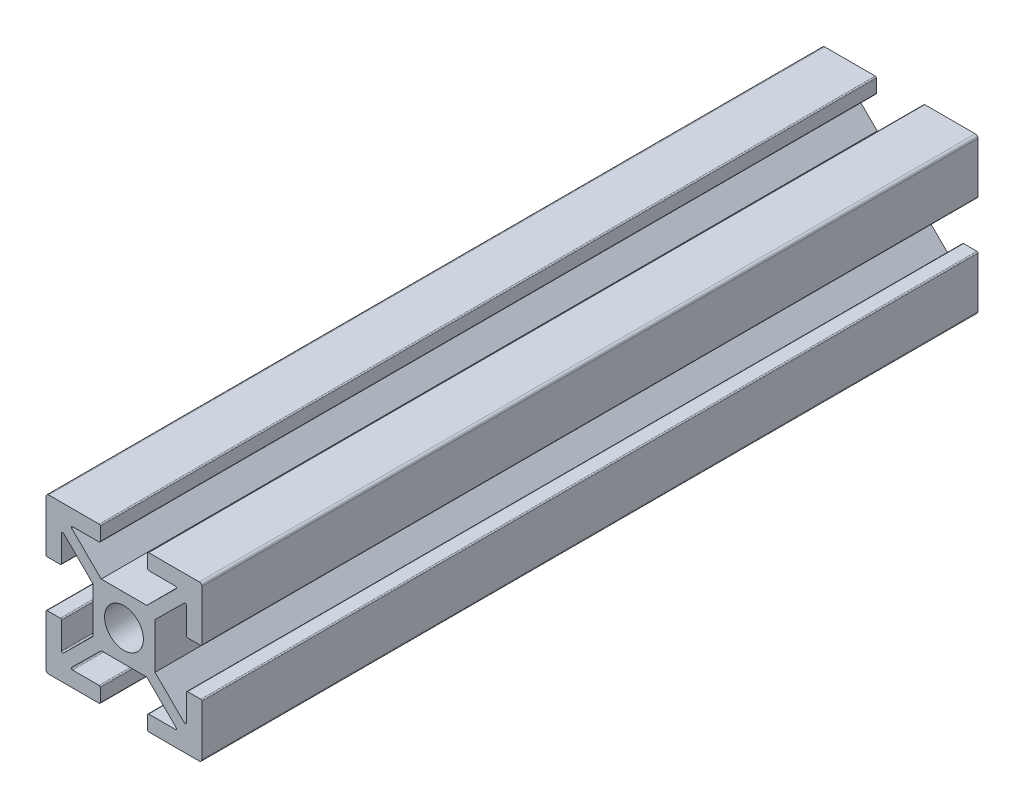
from build123d import *

# Parameters (mm, degrees)
SKETCH1_R           = 2.5
BOSS_EXTRUDE1_DEPTH = 100


with BuildPart() as part:
    # Sketch1 → Boss-Extrude1 (new body)
    with BuildSketch(Plane.XY):
        with BuildLine():
            Line((-7.427382464, 2.155691805), (-5.727382464, 2.155691805))
            ThreePointArc((-5.727382464, 2.155691805), (-5.621316447, 2.199625788), (-5.577382464, 2.305691805))
            Line((-5.577382464, 2.305691805), (-5.577382464, 5.741876319))
            ThreePointArc((-5.577382464, 5.741876319), (-5.485183419, 5.880292537), (-5.321928469, 5.848550846))
            Line((-5.321928469, 5.848550846), (-1.531086168, 2.101082027))
            Line((-1.531086168, 2.101082027), (-1.531086168, -3.789698417))
            Line((-1.531086168, -3.789698417), (-5.321928469, -7.537167236))
            ThreePointArc((-5.321928469, -7.537167236), (-5.485183419, -7.568908927), (-5.577382464, -7.430492708))
            Line((-5.577382464, -7.430492708), (-5.577382464, -3.994308195))
            ThreePointArc((-5.577382464, -3.994308195), (-5.621316447, -3.888242178), (-5.727382464, -3.844308195))
            Line((-5.727382464, -3.844308195), (-7.427382464, -3.844308195))
            ThreePointArc((-7.427382464, -3.844308195), (-7.533448481, -3.888242178), (-7.577382464, -3.994308195))
            Line((-7.577382464, -3.994308195), (-7.577382464, -10.494308195))
            ThreePointArc((-7.577382464, -10.494308195), (-7.474869837, -10.741795568), (-7.227382464, -10.844308195))
            Line((-7.227382464, -10.844308195), (-0.727382464, -10.844308195))
            ThreePointArc((-0.727382464, -10.844308195), (-0.621316447, -10.800374212), (-0.577382464, -10.694308195))
            Line((-0.577382464, -10.694308195), (-0.577382464, -8.994308195))
            ThreePointArc((-0.577382464, -8.994308195), (-0.621316447, -8.888242178), (-0.727382464, -8.844308195))
            Line((-0.727382464, -8.844308195), (-4.145467261, -8.844308195))
            ThreePointArc((-4.145467261, -8.844308195), (-4.284213755, -8.751311795), (-4.250921257, -8.587633667))
            Line((-4.250921257, -8.587633667), (-0.464270258, -4.844308195))
            Line((-0.464270258, -4.844308195), (5.402097922, -4.844308195))
            Line((5.402097922, -4.844308195), (9.188748921, -8.587633667))
            ThreePointArc((9.188748921, -8.587633667), (9.22204142, -8.751311795), (9.083294926, -8.844308195))
            Line((9.083294926, -8.844308195), (5.665210129, -8.844308195))
            ThreePointArc((5.665210129, -8.844308195), (5.559144111, -8.888242178), (5.515210129, -8.994308195))
            Line((5.515210129, -8.994308195), (5.515210129, -10.694308195))
            ThreePointArc((5.515210129, -10.694308195), (5.559144111, -10.800374212), (5.665210129, -10.844308195))
            Line((5.665210129, -10.844308195), (12.165210129, -10.844308195))
            ThreePointArc((12.165210129, -10.844308195), (12.412697502, -10.741795568), (12.515210129, -10.494308195))
            Line((12.515210129, -10.494308195), (12.515210129, -3.994308195))
            ThreePointArc((12.515210129, -3.994308195), (12.471276146, -3.888242178), (12.365210129, -3.844308195))
            Line((12.365210129, -3.844308195), (10.665210129, -3.844308195))
            ThreePointArc((10.665210129, -3.844308195), (10.559144111, -3.888242178), (10.515210129, -3.994308195))
            Line((10.515210129, -3.994308195), (10.515210129, -7.430492708))
            ThreePointArc((10.515210129, -7.430492708), (10.423011083, -7.568908927), (10.259756133, -7.537167236))
            Line((10.259756133, -7.537167236), (6.468913832, -3.789698417))
            Line((6.468913832, -3.789698417), (6.468913832, 2.101082027))
            Line((6.468913832, 2.101082027), (10.259756133, 5.848550846))
            ThreePointArc((10.259756133, 5.848550846), (10.423011083, 5.880292537), (10.515210129, 5.741876319))
            Line((10.515210129, 5.741876319), (10.515210129, 2.305691805))
            ThreePointArc((10.515210129, 2.305691805), (10.559144111, 2.199625788), (10.665210129, 2.155691805))
            Line((10.665210129, 2.155691805), (12.365210129, 2.155691805))
            ThreePointArc((12.365210129, 2.155691805), (12.471276146, 2.199625788), (12.515210129, 2.305691805))
            Line((12.515210129, 2.305691805), (12.515210129, 8.805691805))
            ThreePointArc((12.515210129, 8.805691805), (12.412697502, 9.053179179), (12.165210129, 9.155691805))
            Line((12.165210129, 9.155691805), (5.665210129, 9.155691805))
            ThreePointArc((5.665210129, 9.155691805), (5.559144111, 9.111757822), (5.515210129, 9.005691805))
            Line((5.515210129, 9.005691805), (5.515210129, 7.305691805))
            ThreePointArc((5.515210129, 7.305691805), (5.559144111, 7.199625788), (5.665210129, 7.155691805))
            Line((5.665210129, 7.155691805), (9.083294926, 7.155691805))
            ThreePointArc((9.083294926, 7.155691805), (9.22204142, 7.062695405), (9.188748921, 6.899017277))
            Line((9.188748921, 6.899017277), (5.402097922, 3.155691805))
            Line((5.402097922, 3.155691805), (-0.464270258, 3.155691805))
            Line((-0.464270258, 3.155691805), (-4.250921257, 6.899017277))
            ThreePointArc((-4.250921257, 6.899017277), (-4.284213755, 7.062695405), (-4.145467261, 7.155691805))
            Line((-4.145467261, 7.155691805), (-0.727382464, 7.155691805))
            ThreePointArc((-0.727382464, 7.155691805), (-0.621316447, 7.199625788), (-0.577382464, 7.305691805))
            Line((-0.577382464, 7.305691805), (-0.577382464, 9.005691805))
            ThreePointArc((-0.577382464, 9.005691805), (-0.621316447, 9.111757822), (-0.727382464, 9.155691805))
            Line((-0.727382464, 9.155691805), (-7.227382464, 9.155691805))
            ThreePointArc((-7.227382464, 9.155691805), (-7.474869837, 9.053179179), (-7.577382464, 8.805691805))
            Line((-7.577382464, 8.805691805), (-7.577382464, 2.305691805))
            ThreePointArc((-7.577382464, 2.305691805), (-7.533448481, 2.199625788), (-7.427382464, 2.155691805))
        make_face()
        with Locations((2.468913832, -0.844308195)):
            Circle(SKETCH1_R, mode=Mode.SUBTRACT)
    extrude(amount=BOSS_EXTRUDE1_DEPTH)


solid = part.part
